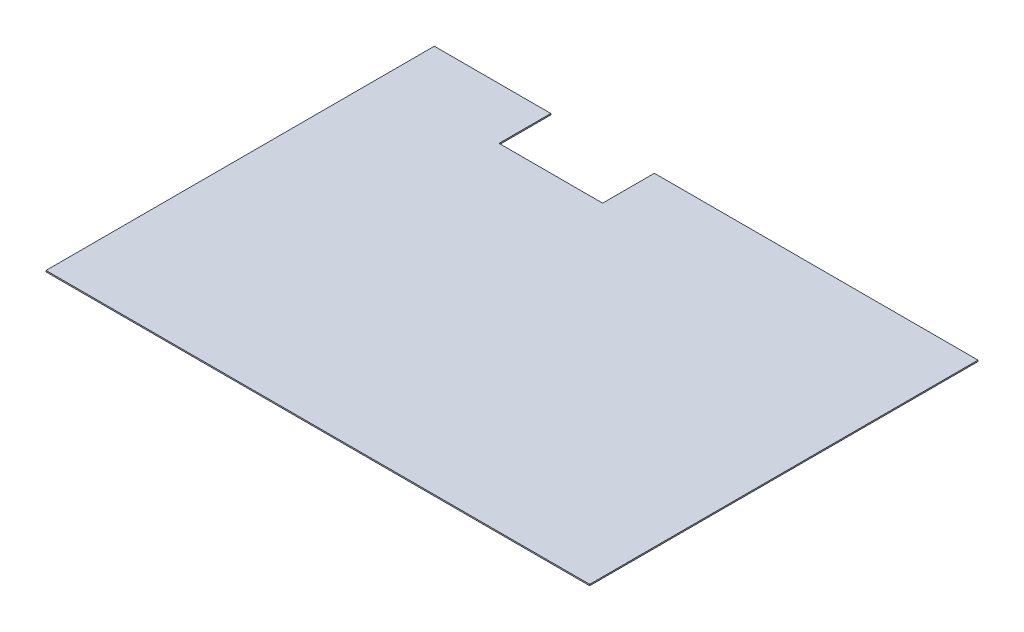
from build123d import *

# Parameters (mm, degrees)
SKETCH1_W           = 1066.8
SKETCH1_H           = 762
BOSS_EXTRUDE1_DEPTH = 2.54
SKETCH2_W           = 203.2
SKETCH2_H           = 101.6
CUT_EXTRUDE1_DEPTH  = 656.50210648


with BuildPart() as part:
    # Sketch1 → Boss-Extrude1 (new body)
    with BuildSketch(Plane(origin=(0, 0, 0), x_dir=(1, 0, 0), z_dir=(0, 1, 0))):
        Rectangle(SKETCH1_W, SKETCH1_H)
    extrude(amount=BOSS_EXTRUDE1_DEPTH)

    # Sketch2 → Cut-Extrude1 (cut, through all)
    with BuildSketch(Plane(origin=(0, 2.54, 0), x_dir=(1, 0, 0), z_dir=(0, 1, 0))):
        with Locations((-203.2, 330.2)):
            Rectangle(SKETCH2_W, SKETCH2_H)
    extrude(amount=-CUT_EXTRUDE1_DEPTH, mode=Mode.SUBTRACT)


solid = part.part
